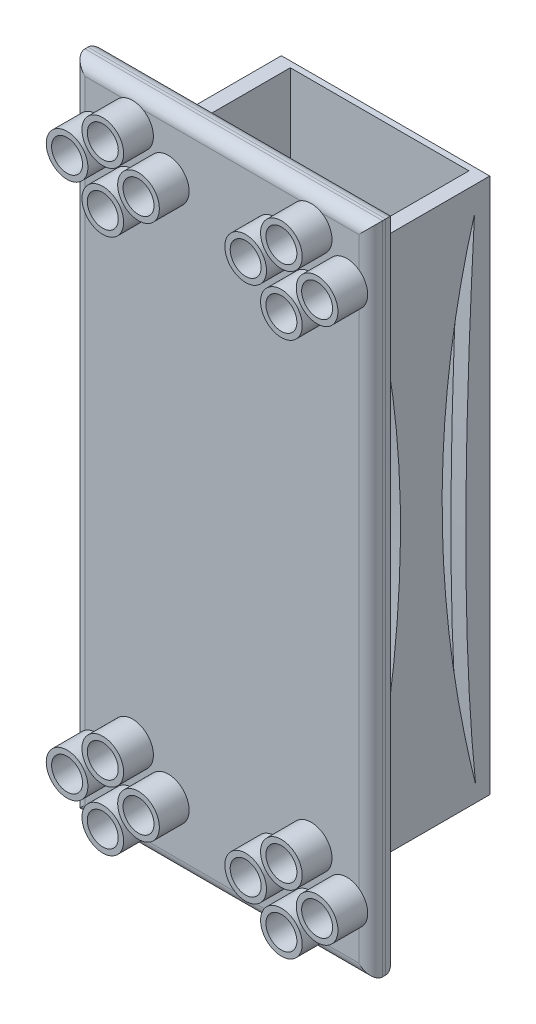
from build123d import *

# Parameters (mm, degrees)
CROQUIS1_W              = 50
CROQUIS1_H              = 110
SALIENTE_EXTRUIR1_DEPTH = 4.5
REDONDEO1_R             = 2
CROQUIS2_R              = 3.5
CROQUIS2_R_2            = 2.6
SALIENTE_EXTRUIR2_DEPTH = 5
CROQUIS3_W              = 35
CROQUIS3_H              = 90
SALIENTE_EXTRUIR3_DEPTH = 23
CROQUIS5_W              = 30
CROQUIS5_H              = 21
CORTAR_EXTRUIR2_DEPTH   = 106.61249926
CORTAR_EXTRUIR4_DEPTH   = 10
CORTAR_EXTRUIR5_DEPTH   = 10


with BuildPart() as part:
    # Croquis1 → Saliente-Extruir1 (new body)
    with BuildSketch(Plane.XY):
        Rectangle(CROQUIS1_W, CROQUIS1_H)
    extrude(amount=SALIENTE_EXTRUIR1_DEPTH)

    # Redondeo1
    redondeo1_edges = [part.edges().sort_by_distance(p)[0] for p in [
        (0, 55, 0),
        (0, 55, 4.5),
        (-25, 0, 0),
        (-25, 0, 4.5),
        (0, -55, 0),
        (0, -55, 4.5),
        (25, 0, 0),
        (25, 0, 4.5),
    ]]
    fillet(redondeo1_edges, radius=REDONDEO1_R)

    # Croquis2 → Saliente-Extruir2 (add)
    # profile 1 of 16: a face of its own
    with BuildSketch(Plane.XY.offset(4.5)):
        with Locations((-15, 50)):
            Circle(CROQUIS2_R)
        with Locations((-15, 50)):
            Circle(CROQUIS2_R_2, mode=Mode.SUBTRACT)
    # profile 2 of 16: a face of its own
    with BuildSketch(Plane.XY.offset(4.5)):
        with Locations((-15, 40)):
            Circle(CROQUIS2_R)
        with Locations((-15, 40)):
            Circle(CROQUIS2_R_2, mode=Mode.SUBTRACT)
    # profile 3 of 16: a face of its own
    with BuildSketch(Plane.XY.offset(4.5)):
        with Locations((-9, 45)):
            Circle(CROQUIS2_R)
        with Locations((-9, 45)):
            Circle(CROQUIS2_R_2, mode=Mode.SUBTRACT)
    # profile 4 of 16: a face of its own
    with BuildSketch(Plane.XY.offset(4.5)):
        with Locations((-21, 45)):
            Circle(CROQUIS2_R)
        with Locations((-21, 45)):
            Circle(CROQUIS2_R_2, mode=Mode.SUBTRACT)
    # profile 5 of 16: a face of its own
    with BuildSketch(Plane.XY.offset(4.5)):
        with Locations((21, 45)):
            Circle(CROQUIS2_R)
        with Locations((21, 45)):
            Circle(CROQUIS2_R_2, mode=Mode.SUBTRACT)
    # profile 6 of 16: a face of its own
    with BuildSketch(Plane.XY.offset(4.5)):
        with Locations((15, 40)):
            Circle(CROQUIS2_R)
        with Locations((15, 40)):
            Circle(CROQUIS2_R_2, mode=Mode.SUBTRACT)
    # profile 7 of 16: a face of its own
    with BuildSketch(Plane.XY.offset(4.5)):
        with Locations((9, 45)):
            Circle(CROQUIS2_R)
        with Locations((9, 45)):
            Circle(CROQUIS2_R_2, mode=Mode.SUBTRACT)
    # profile 8 of 16: a face of its own
    with BuildSketch(Plane.XY.offset(4.5)):
        with Locations((15, 50)):
            Circle(CROQUIS2_R)
        with Locations((15, 50)):
            Circle(CROQUIS2_R_2, mode=Mode.SUBTRACT)
    # profile 9 of 16: a face of its own
    with BuildSketch(Plane.XY.offset(4.5)):
        with Locations((15, -40)):
            Circle(CROQUIS2_R)
        with Locations((15, -40)):
            Circle(CROQUIS2_R_2, mode=Mode.SUBTRACT)
    # profile 10 of 16: a face of its own
    with BuildSketch(Plane.XY.offset(4.5)):
        with Locations((21, -45)):
            Circle(CROQUIS2_R)
        with Locations((21, -45)):
            Circle(CROQUIS2_R_2, mode=Mode.SUBTRACT)
    # profile 11 of 16: a face of its own
    with BuildSketch(Plane.XY.offset(4.5)):
        with Locations((9, -45)):
            Circle(CROQUIS2_R)
        with Locations((9, -45)):
            Circle(CROQUIS2_R_2, mode=Mode.SUBTRACT)
    # profile 12 of 16: a face of its own
    with BuildSketch(Plane.XY.offset(4.5)):
        with Locations((15, -50)):
            Circle(CROQUIS2_R)
        with Locations((15, -50)):
            Circle(CROQUIS2_R_2, mode=Mode.SUBTRACT)
    # profile 13 of 16: a face of its own
    with BuildSketch(Plane.XY.offset(4.5)):
        with Locations((-15, -40)):
            Circle(CROQUIS2_R)
        with Locations((-15, -40)):
            Circle(CROQUIS2_R_2, mode=Mode.SUBTRACT)
    # profile 14 of 16: a face of its own
    with BuildSketch(Plane.XY.offset(4.5)):
        with Locations((-9, -45)):
            Circle(CROQUIS2_R)
        with Locations((-9, -45)):
            Circle(CROQUIS2_R_2, mode=Mode.SUBTRACT)
    # profile 15 of 16: a face of its own
    with BuildSketch(Plane.XY.offset(4.5)):
        with Locations((-21, -45)):
            Circle(CROQUIS2_R)
        with Locations((-21, -45)):
            Circle(CROQUIS2_R_2, mode=Mode.SUBTRACT)
    # profile 16 of 16: a face of its own
    with BuildSketch(Plane.XY.offset(4.5)):
        with Locations((-15, -50)):
            Circle(CROQUIS2_R)
        with Locations((-15, -50)):
            Circle(CROQUIS2_R_2, mode=Mode.SUBTRACT)
    extrude(amount=SALIENTE_EXTRUIR2_DEPTH)

    # Croquis3 → Saliente-Extruir3 (add)
    with BuildSketch(Plane(origin=(0, 0, 0), x_dir=(-1, 0, 0), z_dir=(0, 0, -1))):
        Rectangle(CROQUIS3_W, CROQUIS3_H)
    extrude(amount=SALIENTE_EXTRUIR3_DEPTH)

    # Croquis5 → Cortar-Extruir2 (cut, through all)
    with BuildSketch(Plane(origin=(0, 45, 0), x_dir=(1, 0, 0), z_dir=(0, 1, 0))):
        with Locations((0, 11.5)):
            Rectangle(CROQUIS5_W, CROQUIS5_H)
    extrude(amount=-CORTAR_EXTRUIR2_DEPTH, mode=Mode.SUBTRACT)

    # Croquis7 → Cortar-Extruir4 (cut)
    with BuildSketch(Plane.ZY.offset(17.5)):
        Polygon((-15.047295785, 14.808167615), (-19.203160033, 12.99310964), (-15.665473408, 9.937360437), (-16.287856832, 5.033414493), (-12.053495915, 6.817440977), (-7.830916468, 3.170101587), (-7.074130605, 8.915353688), (-3.449369764, 10.442542671), (-6.517294779, 13.142655438), (-5.763831244, 18.862685602), (-10.611102479, 16.745658244), (-14.380375291, 20.063034513), align=None)
        with BuildLine():
            add(Edge.make_bspline(
                [(-21.408360481, -7.762503909), (-17.763506305, -12.708708723), (-10.693467631, -23.108472428), (-3.641142742, -7.047797831)],
                knots=[0, 0, 0, 0, 1, 1, 1, 1], degree=3))
            add(Edge.make_bspline(
                [(-21.408360481, -7.762503909), (-21.767705448, -28.605682654), (-0.342880562, -25.676501046), (-3.641142742, -7.047797831)],
                knots=[0, 0, 0, 0, 1, 1, 1, 1], degree=3))
        make_face()
    extrude(amount=-CORTAR_EXTRUIR4_DEPTH, mode=Mode.SUBTRACT)

    # Croquis8 → Cortar-Extruir5 (cut)
    with BuildSketch(Plane(origin=(17.5, 0, 0), x_dir=(0, 0, -1), z_dir=(1, 0, 0))):
        with BuildLine():
            add(Edge.make_bspline(
                [(2.569348743, 40.716245485), (9.080503754, 18.53762373), (10.580801765, -9.48585487), (2.377628668, -42.298547258)],
                knots=[0, 0, 0, 0, 1, 1, 1, 1], degree=3))
            add(Edge.make_bspline(
                [(2.377628668, -42.298547258), (5.133604453, -15.937039747), (3.893375388, 16.552759214), (2.569348743, 40.716245485)],
                knots=[0, 0, 0, 0, 1, 1, 1, 1], degree=3))
        make_face()
        with BuildLine():
            add(Edge.make_bspline(
                [(20.430651257, 40.716245485), (13.919496246, 18.53762373), (12.419198235, -9.48585487), (20.622371332, -42.298547258)],
                knots=[0, 0, 0, 0, 1, 1, 1, 1], degree=3))
            add(Edge.make_bspline(
                [(20.622371332, -42.298547258), (17.866395547, -15.937039747), (19.106624612, 16.552759214), (20.430651257, 40.716245485)],
                knots=[0, 0, 0, 0, 1, 1, 1, 1], degree=3))
        make_face()
    extrude(amount=-CORTAR_EXTRUIR5_DEPTH, mode=Mode.SUBTRACT)


solid = part.part
